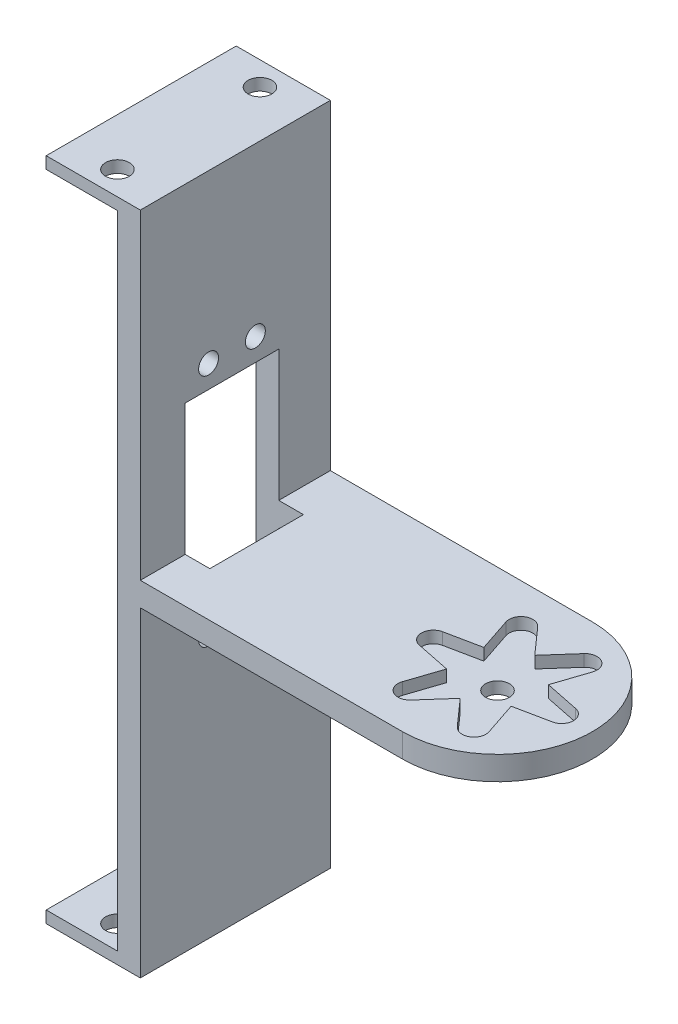
from build123d import *

# Parameters (mm, degrees)
BOSS_EXTRUDE2_DEPTH     = 40
FILLET3_RADIUS          = 20
FILLET3_LENGTH          = 5
SKETCH5_R               = 2.5
CUT_EXTRUDE2_DEPTH      = 40
SKETCH6_R               = 2.1
SKETCH6_W               = 19.7
SKETCH6_H               = 39.9
CUT_EXTRUDE3_DEPTH      = 10
CUT_EXTRUDE4_DEPTH      = 2.5
CUT_EXTRUDE5_DEPTH      = 138
CUT_EXTRUDE5_DEPTH_BACK = 49
SKETCH8_R               = 2.5


with BuildPart() as part:
    # Sketch4 → Boss-Extrude2 (new body)
    with BuildSketch(Plane.XY):
        Polygon((-19.701492537, 42.12238806), (-19.701492537, -27.87761194), (-19.701492537, -92.87761194), (-34.701492537, -92.87761194), (-34.701492537, -95.37761194), (-14.889132329, -95.37761194), (-14.889132329, -27.87761194), (60.298507463, -27.87761194), (60.298507463, -22.87761194), (-14.889132329, -22.87761194), (-14.889132329, 44.62238806), (-34.701492537, 44.62238806), (-34.701492537, 42.12238806), align=None)
    extrude(amount=BOSS_EXTRUDE2_DEPTH)

    # Fillet3: full round fillet: the end face becomes a half cylinder, R = half its width
    fillet3_face = Plane((60.298507463, -25.37761194, 20), x_dir=(0, 1, 0), z_dir=(1, 0, 0))  # on the end face: x along it, z out of the body
    fillet3_slab = fillet3_face.offset(-FILLET3_RADIUS / 2) * Box(FILLET3_LENGTH, 2 * FILLET3_RADIUS, FILLET3_RADIUS, mode=Mode.PRIVATE)  # the body's end, R deep
    fillet3_round = Plane((40.298507463, -25.37761194, 20), x_dir=(1, 0, 0), z_dir=(0, 1, 0)) * Cylinder(FILLET3_RADIUS, FILLET3_LENGTH, mode=Mode.PRIVATE)  # its axis R under the face
    add(fillet3_slab - fillet3_round, mode=Mode.SUBTRACT)

    # Sketch5 → Cut-Extrude2 (cut)
    with BuildSketch(Plane(origin=(0, -22.87761194, 0), x_dir=(1, 0, 0), z_dir=(0, 1, 0))):
        with Locations(Location((40.298507463, -20, 0), (0, 0, 270))):
            Circle(SKETCH5_R)
    extrude(amount=-CUT_EXTRUDE2_DEPTH, mode=Mode.SUBTRACT)

    # Sketch6 → Cut-Extrude3 (cut)
    with BuildSketch(Plane.ZY.offset(19.701492537)):
        with Locations(Location((15.780795158, 9.470750249, 0), (0, 0, 270))):
            Circle(SKETCH6_R)
        with Locations(Location((25.630795158, 9.470750249, 0), (0, 0, 270))):
            Circle(SKETCH6_R)
        with Locations(Location((15.780795158, -39.951540987, 0), (0, 0, 270))):
            Circle(SKETCH6_R)
        with Locations(Location((25.630795158, -39.951540987, 0), (0, 0, 270))):
            Circle(SKETCH6_R)
        with Locations((20.705795158, -15.240395369)):
            Rectangle(SKETCH6_W, SKETCH6_H)
    extrude(amount=-CUT_EXTRUDE3_DEPTH, mode=Mode.SUBTRACT)

    # Sketch7 → Cut-Extrude4 (cut)
    with BuildSketch(Plane(origin=(0, -22.87761194, 0), x_dir=(1, 0, 0), z_dir=(0, 1, 0))):
        with BuildLine():
            Line((35.419373283, -6.650386539), (40.298507463, -12.155040525))
            Line((40.298507463, -12.155040525), (45.177641643, -6.650386539))
            ThreePointArc((45.177641643, -6.650386539), (48.298507463, -6.143593539), (49.42004476, -9.099739121))
            Line((49.42004476, -9.099739121), (47.09244166, -16.077520262))
            Line((47.09244166, -16.077520262), (54.29917894, -17.550647418))
            ThreePointArc((54.29917894, -17.550647418), (56.298507463, -20), (54.29917894, -22.449352582))
            Line((54.29917894, -22.449352582), (47.09244166, -23.922479738))
            Line((47.09244166, -23.922479738), (49.42004476, -30.900260879))
            ThreePointArc((49.42004476, -30.900260879), (48.298507463, -33.856406461), (45.177641643, -33.349613461))
            Line((45.177641643, -33.349613461), (40.298507463, -27.844959475))
            Line((40.298507463, -27.844959475), (35.419373283, -33.349613461))
            ThreePointArc((35.419373283, -33.349613461), (32.298507463, -33.856406461), (31.176970165, -30.900260879))
            Line((31.176970165, -30.900260879), (33.504573265, -23.922479738))
            Line((33.504573265, -23.922479738), (26.297835985, -22.449352582))
            ThreePointArc((26.297835985, -22.449352582), (24.298507463, -20), (26.297835985, -17.550647418))
            Line((26.297835985, -17.550647418), (33.504573265, -16.077520262))
            Line((33.504573265, -16.077520262), (31.176970165, -9.099739121))
            ThreePointArc((31.176970165, -9.099739121), (32.298507463, -6.143593539), (35.419373283, -6.650386539))
        make_face()
    extrude(amount=-CUT_EXTRUDE4_DEPTH, mode=Mode.SUBTRACT)

    # Sketch8 → Cut-Extrude5 (cut, two sides: drawn at the far end of the back side and taken through both)
    with BuildSketch(Plane(origin=(0, 22.12238806, 0), x_dir=(-1, 0, 0), z_dir=(0, -1, 0)).offset(-CUT_EXTRUDE5_DEPTH_BACK)):
        with Locations(Location((24.701492537, -5, 0), (0, 0, 90))):
            Circle(SKETCH8_R)
        with Locations(Location((24.701492537, -35, 0), (0, 0, 90))):
            Circle(SKETCH8_R)
    extrude(amount=CUT_EXTRUDE5_DEPTH + CUT_EXTRUDE5_DEPTH_BACK, mode=Mode.SUBTRACT)


solid = part.part
